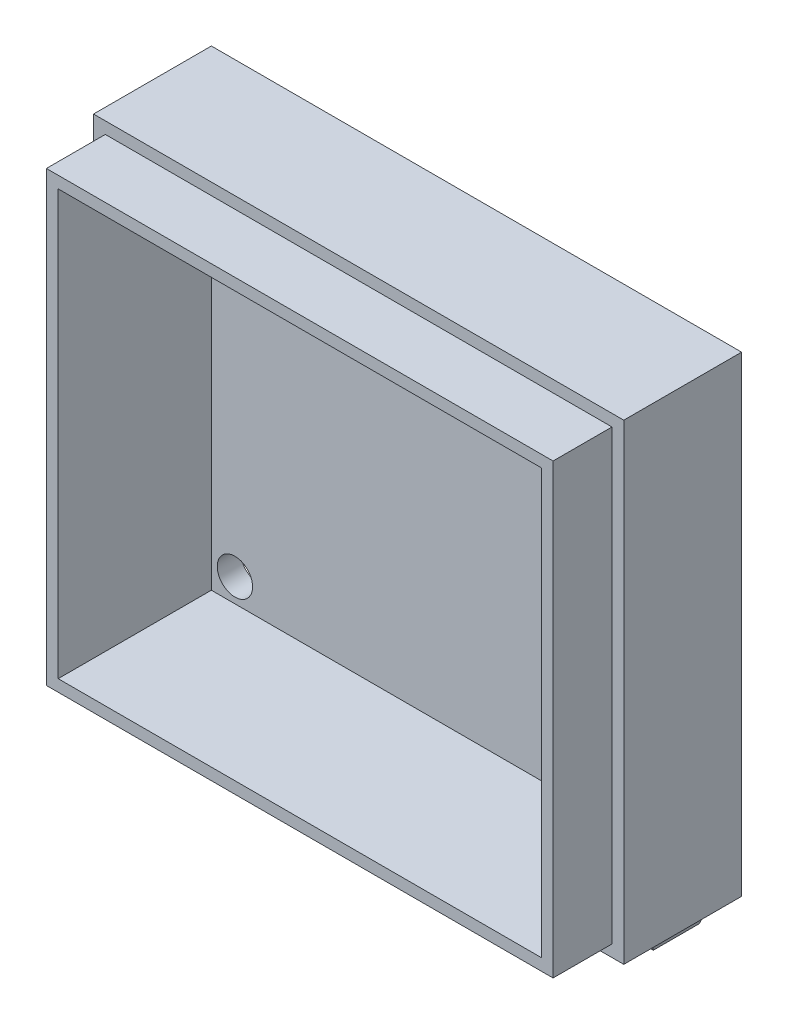
from build123d import *

# Parameters (mm, degrees)
SKETCH1_W                     = 90
SKETCH1_H                     = 80
BOSS_EXTRUDE1_DEPTH           = 30
SHELL1_T                      = -4
SKETCH4_W                     = 7
SKETCH4_H                     = 10
BOSS_EXTRUDE2_DEPTH           = 4
BOSS_EXTRUDE2_DRAFT           = 15
BOSS_EXTRUDE2_PROFILE_2_DEPTH = 4
BOSS_EXTRUDE2_PROFILE_2_DRAFT = 15
SKETCH6_R                     = 3
CUT_EXTRUDE3_DEPTH            = 10
SKETCH8_W                     = 90
SKETCH8_H                     = 80
SKETCH8_W_2                   = 86
SKETCH8_H_2                   = 76
CUT_EXTRUDE4_DEPTH            = 10


with BuildPart() as part:
    # Sketch1 → Boss-Extrude1 (new body)
    with BuildSketch(Plane.XY):
        Rectangle(SKETCH1_W, SKETCH1_H)
    extrude(amount=BOSS_EXTRUDE1_DEPTH)

    # Shell1
    shell1_openings = [part.faces().sort_by_distance(p)[0] for p in [
        (0, 0, 30),
    ]]
    offset(amount=SHELL1_T, openings=shell1_openings, kind=Kind.INTERSECTION)


with BuildPart() as boss_extrude2_tool:
    # Sketch4 → Boss-Extrude2 (with draft: the straight prism first)
    with BuildSketch(Plane.XZ.offset(40)):
        with Locations((-39, 7.5)):
            Rectangle(SKETCH4_W, SKETCH4_H)
    extrude(amount=BOSS_EXTRUDE2_DEPTH)
    # Boss-Extrude2: the draft: its side faces are tilted about the plane it starts from
    boss_extrude2_sides = [boss_extrude2_tool.faces().sort_by_distance(p)[0] for p in [
        (-42.5, -42, 7.5),
        (-39, -42, 2.5),
        (-35.5, -42, 7.5),
        (-39, -42, 12.5),
    ]]
    draft(boss_extrude2_sides, Plane.XZ.offset(40), BOSS_EXTRUDE2_DRAFT)


with BuildPart() as part_1:
    add(part.part)

    # Boss-Extrude2: add boss_extrude2_tool
    add(boss_extrude2_tool.part)


with BuildPart() as boss_extrude2_profile_2_tool:
    # Sketch4 → Boss-Extrude2 profile 2 (with draft: the straight prism first)
    with BuildSketch(Plane.XZ.offset(40)):
        with Locations((39, 7.5)):
            Rectangle(SKETCH4_W, SKETCH4_H)
    extrude(amount=BOSS_EXTRUDE2_PROFILE_2_DEPTH)
    # Boss-Extrude2 profile 2: the draft: its side faces are tilted about the plane it starts from
    boss_extrude2_profile_2_sides = [boss_extrude2_profile_2_tool.faces().sort_by_distance(p)[0] for p in [
        (35.5, -42, 7.5),
        (39, -42, 2.5),
        (42.5, -42, 7.5),
        (39, -42, 12.5),
    ]]
    draft(boss_extrude2_profile_2_sides, Plane.XZ.offset(40), BOSS_EXTRUDE2_PROFILE_2_DRAFT)


with BuildPart() as part_2:
    add(part_1.part)

    # Boss-Extrude2 profile 2: add boss_extrude2_profile_2_tool
    add(boss_extrude2_profile_2_tool.part)

    # Sketch6 → Cut-Extrude3 (cut)
    with BuildSketch(Plane.XY.offset(4)):
        with Locations((-37, -32)):
            Circle(SKETCH6_R)
    extrude(amount=-CUT_EXTRUDE3_DEPTH, mode=Mode.SUBTRACT)

    # Sketch8 → Cut-Extrude4 (cut)
    with BuildSketch(Plane.XY.offset(30)):
        Rectangle(SKETCH8_W, SKETCH8_H)
        Rectangle(SKETCH8_W_2, SKETCH8_H_2, mode=Mode.SUBTRACT)
    extrude(amount=-CUT_EXTRUDE4_DEPTH, mode=Mode.SUBTRACT)


solid = part_2.part
